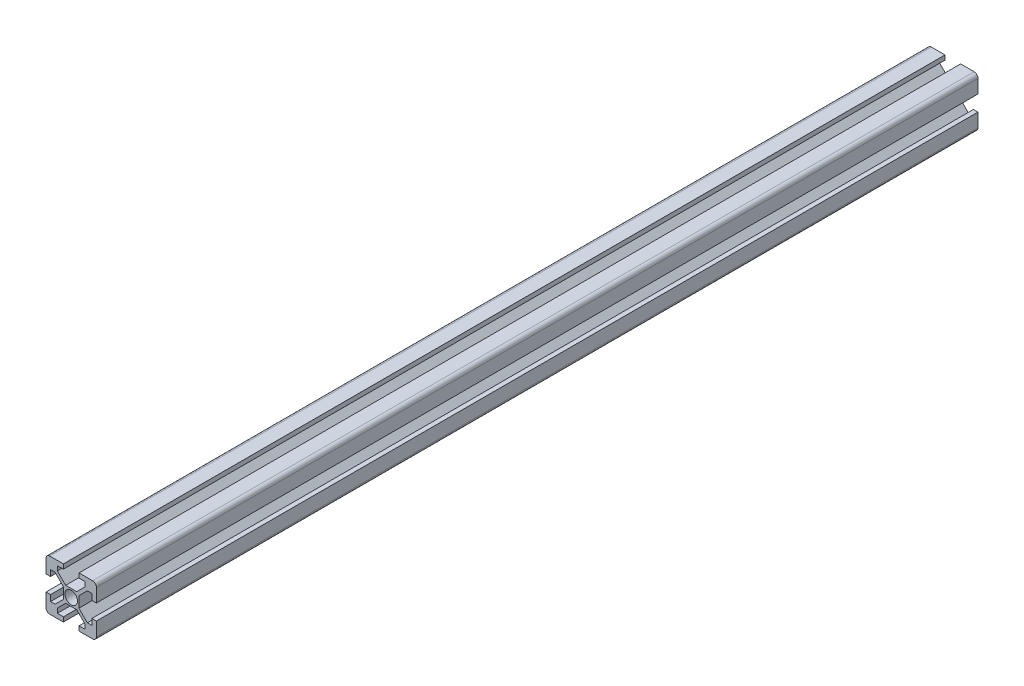
from build123d import *

# Parameters (mm, degrees)
SKETCH_1_R      = 2.5
EXTRUDE_1_DEPTH = 350


with BuildPart() as part:
    # 草图1 → 凸台-拉伸1 (new body)
    with BuildSketch(Plane.XY):
        with BuildLine():
            Line((-8.2, -3.1), (-10, -3.1))
            Line((-10, -3.1), (-10, -8.5))
            ThreePointArc((-10, -8.5), (-9.560660172, -9.560660172), (-8.5, -10))
            Line((-8.5, -10), (-3.1, -10))
            Line((-3.1, -10), (-3.1, -8.2))
            Line((-3.1, -8.2), (-5.5, -8.2))
            Line((-5.5, -8.2), (-5.5, -6.397050155))
            Line((-5.5, -6.397050155), (-2.202949845, -3.1))
            Line((-2.202949845, -3.1), (2.202949845, -3.1))
            Line((2.202949845, -3.1), (5.5, -6.397050155))
            Line((5.5, -6.397050155), (5.5, -8.2))
            Line((5.5, -8.2), (3.1, -8.2))
            Line((3.1, -8.2), (3.1, -10))
            Line((3.1, -10), (8.5, -10))
            ThreePointArc((8.5, -10), (9.560660172, -9.560660172), (10, -8.5))
            Line((10, -8.5), (10, -3.1))
            Line((10, -3.1), (8.2, -3.1))
            Line((8.2, -3.1), (8.2, -5.5))
            Line((8.2, -5.5), (6.397050155, -5.5))
            Line((6.397050155, -5.5), (3.05412702, -2.157076865))
            Line((3.05412702, -2.157076865), (3.05412702, 2.157076865))
            Line((3.05412702, 2.157076865), (6.397050155, 5.5))
            Line((6.397050155, 5.5), (8.2, 5.5))
            Line((8.2, 5.5), (8.2, 3.1))
            Line((8.2, 3.1), (10, 3.1))
            Line((10, 3.1), (10, 8.5))
            ThreePointArc((10, 8.5), (9.560660172, 9.560660172), (8.5, 10))
            Line((8.5, 10), (3.1, 10))
            Line((3.1, 10), (3.1, 8.2))
            Line((3.1, 8.2), (5.5, 8.2))
            Line((5.5, 8.2), (5.5, 6.397050155))
            Line((5.5, 6.397050155), (2.202949845, 3.1))
            Line((2.202949845, 3.1), (-2.202949845, 3.1))
            Line((-2.202949845, 3.1), (-5.5, 6.397050155))
            Line((-5.5, 6.397050155), (-5.5, 8.2))
            Line((-5.5, 8.2), (-3.1, 8.2))
            Line((-3.1, 8.2), (-3.1, 10))
            Line((-3.1, 10), (-8.5, 10))
            ThreePointArc((-8.5, 10), (-9.560660172, 9.560660172), (-10, 8.5))
            Line((-10, 8.5), (-10, 3.1))
            Line((-10, 3.1), (-8.2, 3.1))
            Line((-8.2, 3.1), (-8.2, 5.5))
            Line((-8.2, 5.5), (-6.397050155, 5.5))
            Line((-6.397050155, 5.5), (-3.05412702, 2.157076865))
            Line((-3.05412702, 2.157076865), (-3.05412702, -2.157076865))
            Line((-3.05412702, -2.157076865), (-6.397050155, -5.5))
            Line((-6.397050155, -5.5), (-8.2, -5.5))
            Line((-8.2, -5.5), (-8.2, -3.1))
        make_face()
        Circle(SKETCH_1_R, mode=Mode.SUBTRACT)
    extrude(amount=EXTRUDE_1_DEPTH)


solid = part.part
